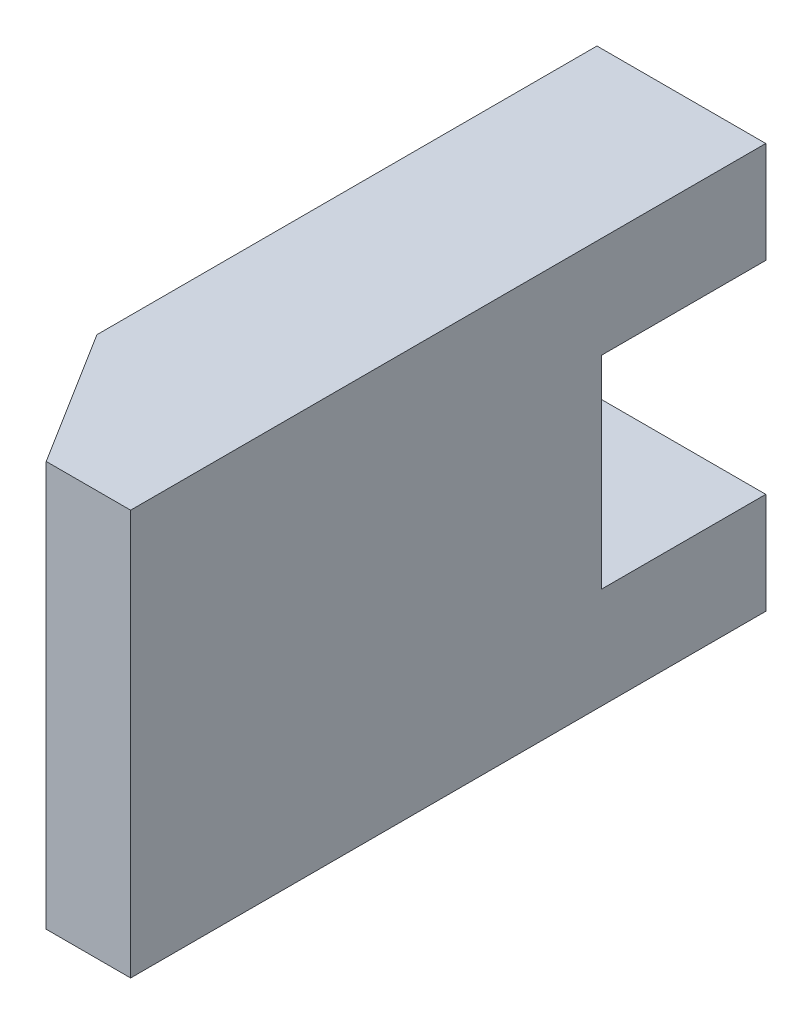
from build123d import *

# Parameters (mm, degrees)
BOSS_EXTRUDE1_DEPTH = 5
CUT_EXTRUDE1_DEPTH  = 23.867116988


with BuildPart() as part:
    # Sketch1 → Boss-Extrude1 (new body)
    with BuildSketch(Plane(origin=(0, 0, 0), x_dir=(0, 0, -1), z_dir=(1, 0, 0))):
        Polygon((0, 6), (0, -6), (18.812364002, -6), (18.812364002, -3), (13.95008688, -3), (13.95008688, 3), (18.812364002, 3), (18.812364002, 6), align=None)
    extrude(amount=BOSS_EXTRUDE1_DEPTH)

    # Sketch2 → Cut-Extrude1 (cut, through all)
    with BuildSketch(Plane(origin=(0, 6, 0), x_dir=(1, 0, 0), z_dir=(0, 1, 0))):
        Polygon((0, 4), (0, 0), (2.5, 0), align=None)
    extrude(amount=-CUT_EXTRUDE1_DEPTH, mode=Mode.SUBTRACT)


solid = part.part
